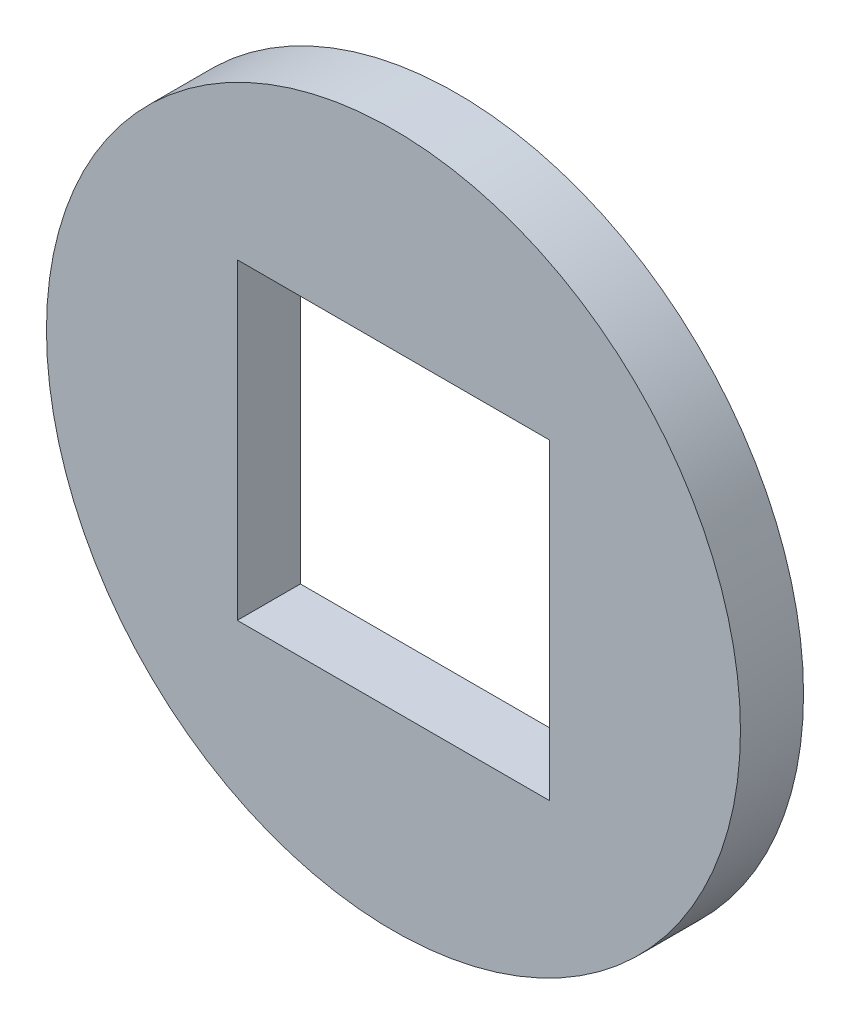
from build123d import *

# Parameters (mm, degrees)
ESQUISSE1_R      = 5.5
ESQUISSE1_W      = 4.949747468
ESQUISSE1_H      = 4.949747468
EXTRUSION1_DEPTH = 1


with BuildPart() as part:
    # Esquisse1 → Extrusion1 (new body)
    with BuildSketch(Plane.XY):
        Circle(ESQUISSE1_R)
        Rectangle(ESQUISSE1_W, ESQUISSE1_H, mode=Mode.SUBTRACT)
    extrude(amount=EXTRUSION1_DEPTH)


solid = part.part
